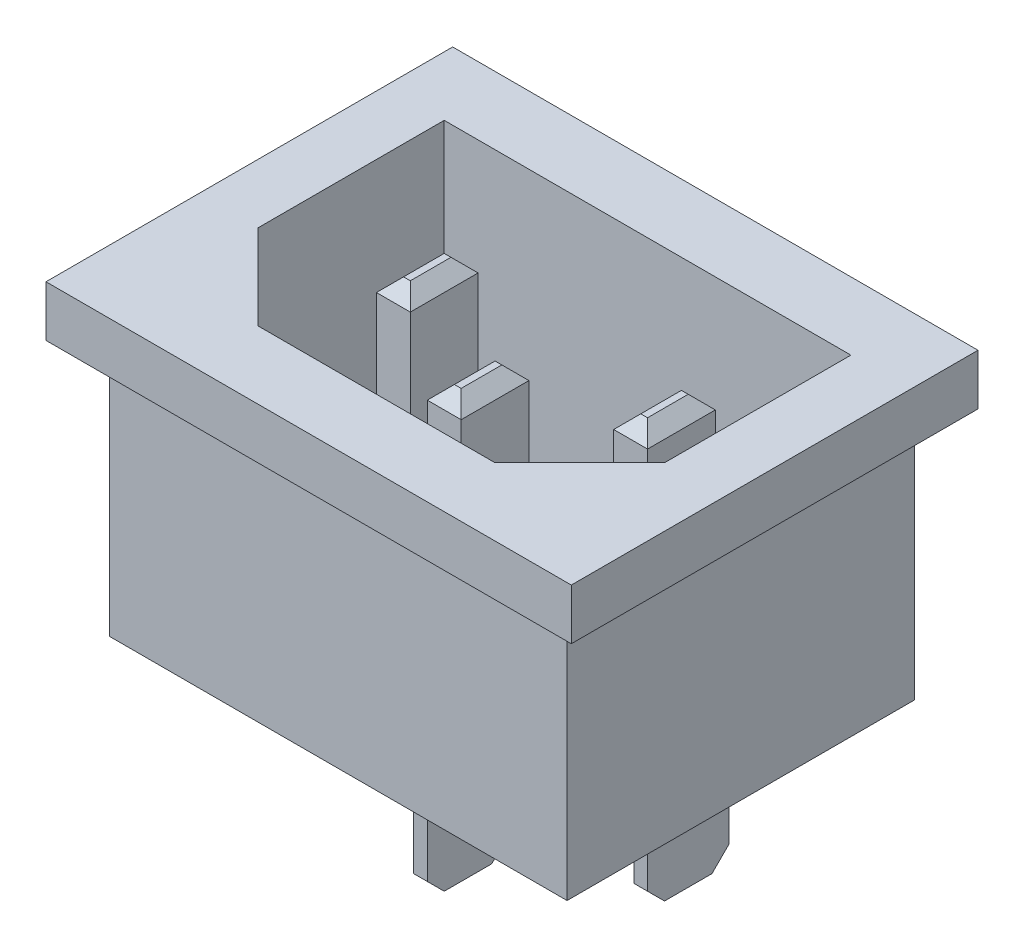
from build123d import *

# Parameters (mm, degrees)
SKETCH_1_W          = 27
SKETCH_1_H          = 20.5
EXTRUDE_1_DEPTH     = 15
SKETCH_2_W          = 0.8
SKETCH_2_H          = 4.8
EXTRUDE_2_DEPTH     = 9
CHAMFER_1_SIZE      = 1
SKETCH_3_W          = 31
SKETCH_3_H          = 24
EXTRUDE_3_DEPTH     = 3
CUT_EXTRUDE_1_DEPTH = 17
SKETCH_5_W          = 2
SKETCH_5_H          = 4
EXTRUDE_4_DEPTH     = 15
CHAMFER_2_SIZE      = 0.8


with BuildPart() as part:
    # Эскиз1 → Бобышка-Вытянуть1 (new body)
    with BuildSketch(Plane(origin=(0, 0, 0), x_dir=(1, 0, 0), z_dir=(0, 1, 0))):
        Rectangle(SKETCH_1_W, SKETCH_1_H)
    extrude(amount=EXTRUDE_1_DEPTH)

    # Эскиз2 → Бобышка-Вытянуть2 (add)
    with BuildSketch(Plane.XZ):
        with Locations((0, 3)):
            Rectangle(SKETCH_2_W, SKETCH_2_H)
        with Locations((-7, -3)):
            Rectangle(SKETCH_2_W, SKETCH_2_H)
        with Locations((7, -3)):
            Rectangle(SKETCH_2_W, SKETCH_2_H)
    extrude(amount=EXTRUDE_2_DEPTH)

    # Фаска1
    chamfer_1_edges = [part.edges().sort_by_distance(p)[0] for p in [
        (-7, -9, -0.6),
        (-7, -9, -5.4),
        (0, -9, 5.4),
        (0, -9, 0.6),
        (7, -9, -0.6),
        (7, -9, -5.4),
    ]]
    chamfer(chamfer_1_edges, length=CHAMFER_1_SIZE)

    # Эскиз3 → Бобышка-Вытянуть3 (add)
    with BuildSketch(Plane(origin=(0, 15, 0), x_dir=(1, 0, 0), z_dir=(0, 1, 0))):
        Rectangle(SKETCH_3_W, SKETCH_3_H)
    extrude(amount=EXTRUDE_3_DEPTH)

    # Эскиз4 → Вырез-Вытянуть1 (cut)
    with BuildSketch(Plane(origin=(0, 18, 0), x_dir=(1, 0, 0), z_dir=(0, 1, 0))):
        Polygon((12, -3), (7, -8), (-7, -8), (-12, -3), (-12, 8), (12, 8), align=None)
    extrude(amount=-CUT_EXTRUDE_1_DEPTH, mode=Mode.SUBTRACT)

    # Эскиз5 → Бобышка-Вытянуть4 (add)
    with BuildSketch(Plane(origin=(0, 1, 0), x_dir=(1, 0, 0), z_dir=(0, 1, 0))):
        with Locations((7, 2)):
            Rectangle(SKETCH_5_W, SKETCH_5_H)
        with Locations((0, -2)):
            Rectangle(SKETCH_5_W, SKETCH_5_H)
        with Locations((-7, 2)):
            Rectangle(SKETCH_5_W, SKETCH_5_H)
    extrude(amount=EXTRUDE_4_DEPTH)

    # Фаска2
    chamfer_2_edges = [part.edges().sort_by_distance(p)[0] for p in [
        (-1, 16, 2),
        (0, 16, 4),
        (1, 16, 2),
        (0, 16, 0),
        (6, 16, -2),
        (7, 16, 0),
        (8, 16, -2),
        (7, 16, -4),
        (-7, 16, -4),
        (-8, 16, -2),
        (-7, 16, 0),
        (-6, 16, -2),
    ]]
    chamfer(chamfer_2_edges, length=CHAMFER_2_SIZE)


solid = part.part
